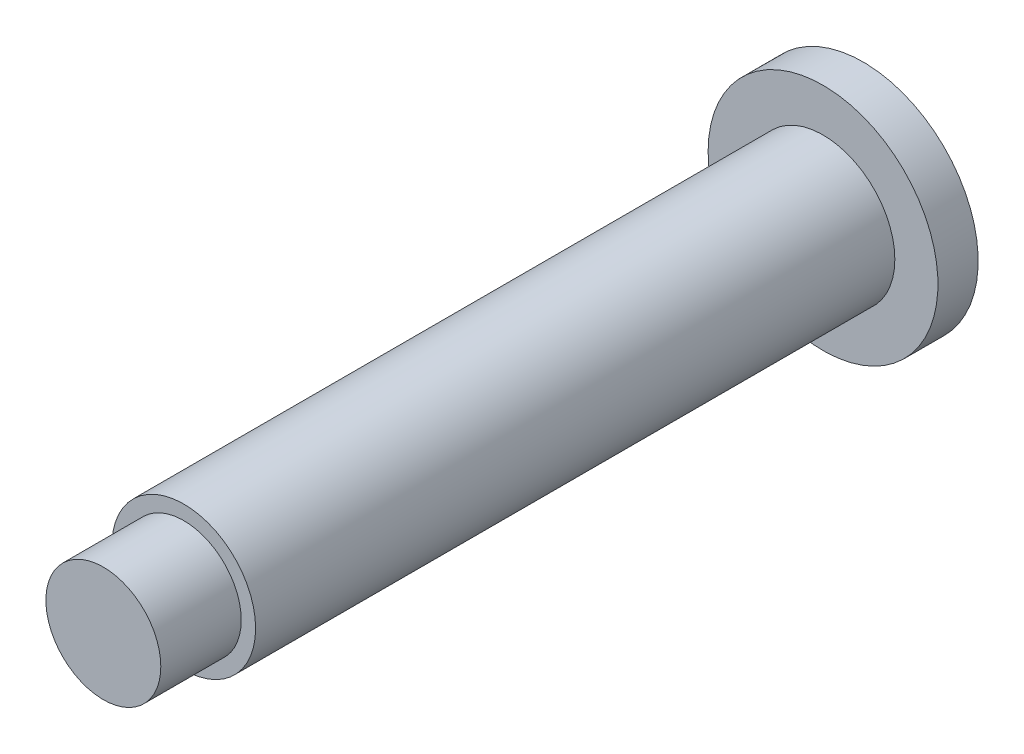
from build123d import *

# Parameters (mm, degrees)
SKETCH1_R           = 2.5
BOSS_EXTRUDE1_DEPTH = 22.25
SKETCH2_R           = 4
BOSS_EXTRUDE2_DEPTH = 1.4
SKETCH3_R           = 2.05
CUT_EXTRUDE1_DEPTH  = 3
SKETCH4_R           = 2
BOSS_EXTRUDE3_DEPTH = 2.8


with BuildPart() as part:
    # Sketch1 → Boss-Extrude1 (new body)
    with BuildSketch(Plane(origin=(0, 0, 0), x_dir=(0, 1, 0), z_dir=(0, 0, 1))):
        with Locations(Location((0, 0, 0), (0, 0, 270))):
            Circle(SKETCH1_R)
    extrude(amount=BOSS_EXTRUDE1_DEPTH)

    # Sketch2 → Boss-Extrude2 (add)
    with BuildSketch(Plane(origin=(0, 0, 0), x_dir=(1, 0, 0), z_dir=(0, 0, -1))):
        with Locations(Location((0, 0, 0), (0, 0, 180))):
            Circle(SKETCH2_R)
    extrude(amount=BOSS_EXTRUDE2_DEPTH)

    # Sketch3 → Cut-Extrude1 (cut)
    with BuildSketch(Plane(origin=(0, 0, -1.4), x_dir=(1, 0, 0), z_dir=(0, 0, -1))):
        with Locations(Location((0, 0, 0), (0, 0, 180))):
            Circle(SKETCH3_R)
    extrude(amount=-CUT_EXTRUDE1_DEPTH, mode=Mode.SUBTRACT)

    # Sketch4 → Boss-Extrude3 (add)
    with BuildSketch(Plane.XY.offset(22.25)):
        Circle(SKETCH4_R)
    extrude(amount=BOSS_EXTRUDE3_DEPTH)


solid = part.part
